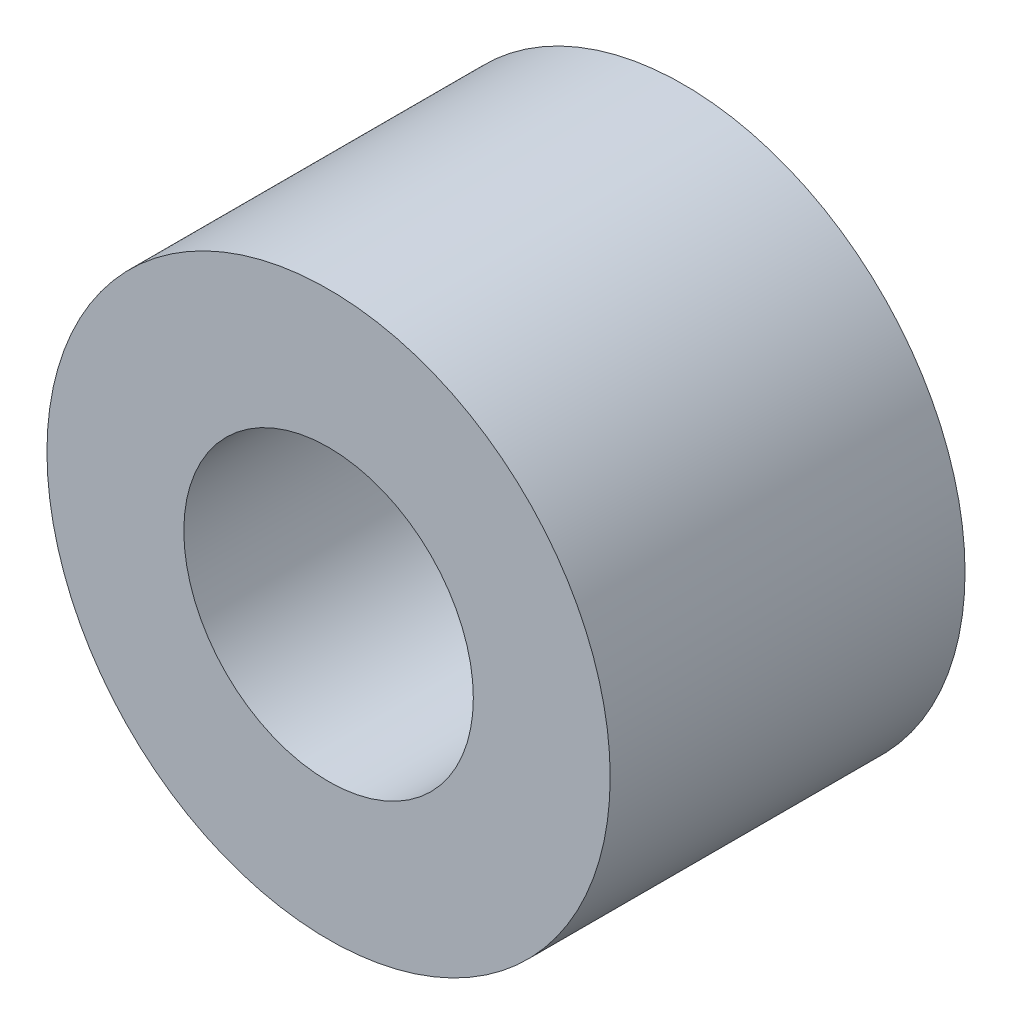
from build123d import *

# Parameters (mm, degrees)
SKETCH1_R           = 6.35
SKETCH1_R_2         = 3.2639
BOSS_EXTRUDE1_DEPTH = 8.001


with BuildPart() as part:
    # Sketch1 → Boss-Extrude1 (new body)
    with BuildSketch(Plane.XY):
        Circle(SKETCH1_R)
        Circle(SKETCH1_R_2, mode=Mode.SUBTRACT)
    extrude(amount=BOSS_EXTRUDE1_DEPTH)


solid = part.part
